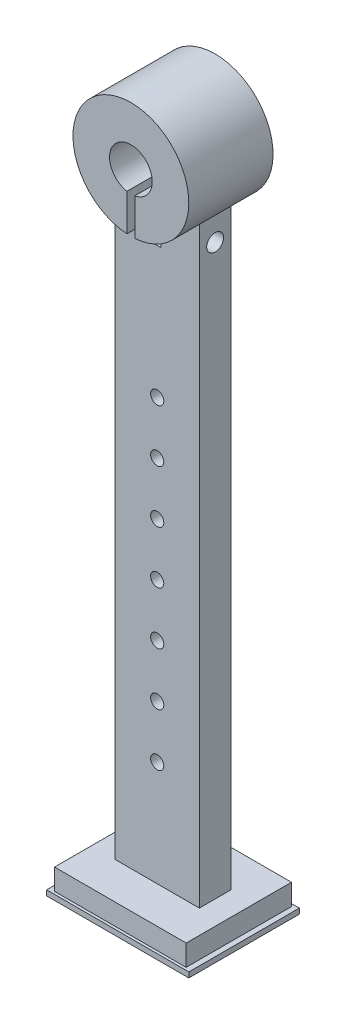
from build123d import *

# Parameters (mm, degrees)
SKETCH_5_R               = 11
SKETCH_5_R_2             = 4.05
EXTRUDE_2_DEPTH          = 8
EXTRUDE_4_DEPTH          = 3
CUT_EXTRUDE_2_DEPTH      = 121.768373343
CUT_EXTRUDE_2_DEPTH_BACK = 121.768373343
SKETCH_6_W               = 1.5
SKETCH_6_H               = 12
CUT_EXTRUDE_3_DEPTH      = 121.768373343
CUT_EXTRUDE_3_DEPTH_BACK = 121.768373343
SKETCH_7_R               = 1.6
SKETCH_8_R               = 1.25
CUT_EXTRUDE_4_DEPTH      = 121.768373343
PATTERN_LINEAR_1_COUNT   = 7
PATTERN_LINEAR_1_PITCH   = 10
SKETCH_9_W               = 25
SKETCH_9_H               = 20
EXTRUDE_5_DEPTH          = 4
SKETCH_10_W              = 27
SKETCH_10_H              = 21
SKETCH_10_W_2            = 23
SKETCH_10_H_2            = 17
EXTRUDE_7_DEPTH          = 1


with BuildPart() as part:
    # 草图5 → 凸台-拉伸2 (new, symmetric)
    with BuildSketch(Plane.XY):
        Circle(SKETCH_5_R)
        Circle(SKETCH_5_R_2, mode=Mode.SUBTRACT)
    extrude(amount=EXTRUDE_2_DEPTH, both=True)

    # 草图5<5> → 凸台-拉伸4 (add, symmetric)
    with BuildSketch(Plane.XY):
        with BuildLine():
            Line((-8, -7.549834435), (-8, -120))
            Line((-8, -120), (8, -120))
            Line((8, -120), (8, -7.549834435))
            ThreePointArc((8, -7.549834435), (0, -11), (-8, -7.549834435))
        make_face()
    extrude(amount=EXTRUDE_4_DEPTH, both=True)

    # 草图6 → 切除-拉伸2 (cut, two sides: drawn at the far end of the back side and taken through both)
    with BuildSketch(Plane.XY.offset(-CUT_EXTRUDE_2_DEPTH_BACK)):
        with Locations((0, -9)):
            Rectangle(SKETCH_6_W, SKETCH_6_H)
    extrude(amount=CUT_EXTRUDE_2_DEPTH + CUT_EXTRUDE_2_DEPTH_BACK, mode=Mode.SUBTRACT)

    # 草图7 → 切除-拉伸3 (cut, two sides: drawn at the far end of the back side and taken through both)
    with BuildSketch(Plane(origin=(0, 0, 0), x_dir=(0, 0, -1), z_dir=(1, 0, 0)).offset(-CUT_EXTRUDE_3_DEPTH_BACK)):
        with Locations((0, -12)):
            Circle(SKETCH_7_R)
    extrude(amount=CUT_EXTRUDE_3_DEPTH + CUT_EXTRUDE_3_DEPTH_BACK, mode=Mode.SUBTRACT)

    # 草图8 → 切除-拉伸4 (cut, symmetric)
    with BuildSketch(Plane.XY):
        with Locations((0, -40)):
            Circle(SKETCH_8_R)
    cut_extrude_4 = extrude(amount=CUT_EXTRUDE_4_DEPTH, both=True, mode=Mode.SUBTRACT)

    # 阵列(线性)1: 切除-拉伸4 ×7
    with Locations(*[(0, -i * PATTERN_LINEAR_1_PITCH, 0) for i in range(1, PATTERN_LINEAR_1_COUNT)]):
        add(cut_extrude_4, mode=Mode.SUBTRACT)

    # 草图9 → 凸台-拉伸5 (add)
    with BuildSketch(Plane.XZ.offset(120)):
        Rectangle(SKETCH_9_W, SKETCH_9_H)
    extrude(amount=EXTRUDE_5_DEPTH)

    # 草图10 → 凸台-拉伸7 (add)
    with BuildSketch(Plane.XZ.offset(124)):
        Rectangle(SKETCH_10_W, SKETCH_10_H)
        Rectangle(SKETCH_10_W_2, SKETCH_10_H_2, mode=Mode.SUBTRACT)
    extrude(amount=EXTRUDE_7_DEPTH)


solid = part.part
